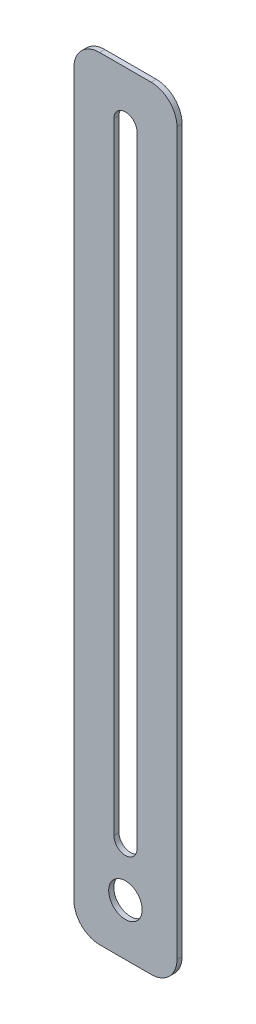
from build123d import *

# Parameters (mm, degrees)
SKETCH1_R           = 6.5
BOSS_EXTRUDE1_DEPTH = 2


with BuildPart() as part:
    # Sketch1 → Boss-Extrude1 (new body)
    with BuildSketch(Plane.XY):
        with BuildLine():
            Line((-10, -150), (10, -150))
            ThreePointArc((10, -150), (17.071067812, -147.071067812), (20, -140))
            Line((20, -140), (20, 140))
            ThreePointArc((20, 140), (17.071067812, 147.071067812), (10, 150))
            Line((10, 150), (-10, 150))
            ThreePointArc((-10, 150), (-17.071067812, 147.071067812), (-20, 140))
            Line((-20, 140), (-20, -140))
            ThreePointArc((-20, -140), (-17.071067812, -147.071067812), (-10, -150))
        make_face()
        with Locations((0, -130)):
            Circle(SKETCH1_R, mode=Mode.SUBTRACT)
        with BuildLine():
            Line((-4.5, -110.5), (-4.5, 130.5))
            ThreePointArc((-4.5, 130.5), (0, 135), (4.5, 130.5))
            Line((4.5, 130.5), (4.5, -110.5))
            ThreePointArc((4.5, -110.5), (0, -115), (-4.5, -110.5))
        make_face(mode=Mode.SUBTRACT)
    extrude(amount=BOSS_EXTRUDE1_DEPTH)


solid = part.part
